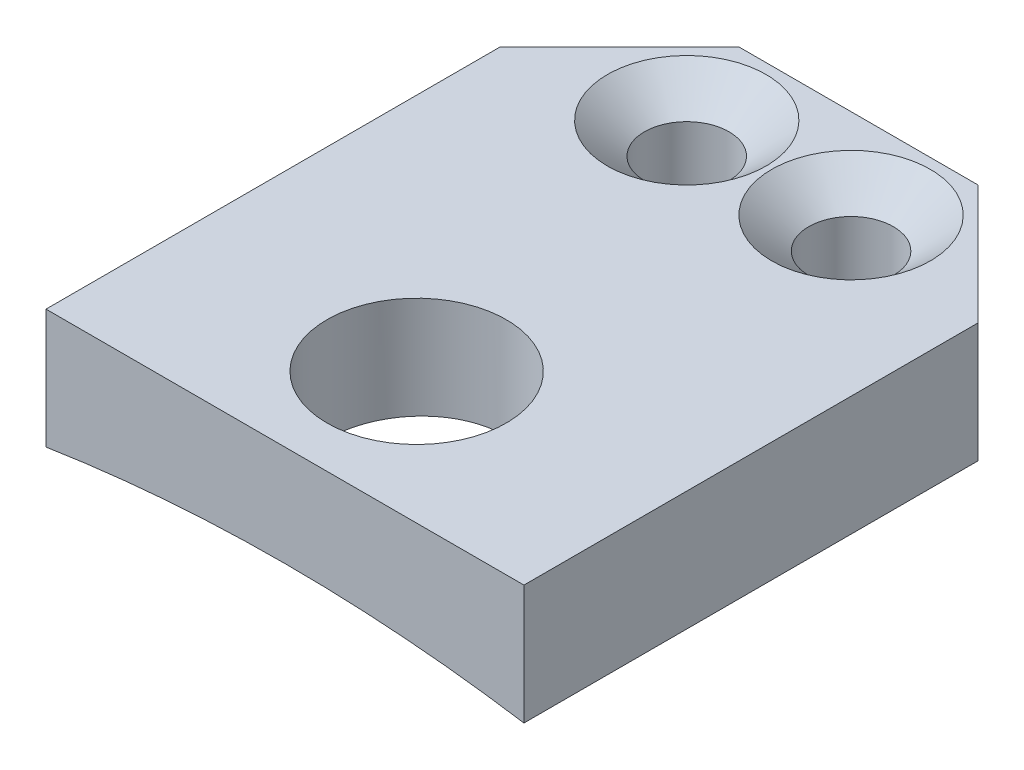
from build123d import *

# Parameters (mm, degrees)
BOSS_EXTRUDE1_DEPTH                               = 6.35
CSK_FOR_8_FLAT_HEAD_MACHINE_SCREW_100_D           = 4.4958
CSK_FOR_8_FLAT_HEAD_MACHINE_SCREW_100_CSINK_D     = 8.4328
CSK_FOR_8_FLAT_HEAD_MACHINE_SCREW_100_CSINK_ANGLE = 100
SKETCH2_R                                         = 82.042
CUT_EXTRUDE1_DEPTH                                = 43.217023873
SKETCH5_R                                         = 1.1303
CUT_EXTRUDE2_DEPTH                                = 35.271884391
SKETCH6_R                                         = 4.7625
CUT_EXTRUDE3_DEPTH                                = 35.271884391


with BuildPart() as part:
    # Sketch1 → Boss-Extrude1 (new body)
    with BuildSketch(Plane(origin=(0, 0, 0), x_dir=(1, 0, 0), z_dir=(0, 1, 0))):
        Polygon((-28.511825699, 11.575271113), (-22.161825699, 17.925271113), (-9.461825699, 17.925271113), (-3.111825699, 11.575271113), (-3.111825699, -12.554728887), (-28.511825699, -12.554728887), align=None)
    extrude(amount=BOSS_EXTRUDE1_DEPTH)

    # CSK for #8 Flat Head Machine Screw (100)1 (through all)
    with Locations(Plane(origin=(0, 6.35, 0), x_dir=(1, 0, 0), z_dir=(0, 1, 0))):
        with Locations((-20.177450699, 13.162771113), (-11.446200699, 13.162771113)):
            CounterSinkHole(CSK_FOR_8_FLAT_HEAD_MACHINE_SCREW_100_D / 2, CSK_FOR_8_FLAT_HEAD_MACHINE_SCREW_100_CSINK_D / 2, counter_sink_angle=CSK_FOR_8_FLAT_HEAD_MACHINE_SCREW_100_CSINK_ANGLE)

    # Sketch2 → Cut-Extrude1 (cut, through all)
    with BuildSketch(Plane.XY.offset(12.554728887)):
        with Locations((-15.811825699, -81.053067579)):
            Circle(SKETCH2_R)
    extrude(amount=-CUT_EXTRUDE1_DEPTH, mode=Mode.SUBTRACT)

    # Sketch5 → Cut-Extrude2 (cut, through all)
    with BuildSketch(Plane(origin=(0, 6.35, 0), x_dir=(1, 0, 0), z_dir=(0, 1, 0))):
        with Locations(Location((-15.799380503, -5.569728887, 0), (0, 0, 270))):
            Circle(SKETCH5_R)
    extrude(amount=-CUT_EXTRUDE2_DEPTH, mode=Mode.SUBTRACT)

    # Sketch6 → Cut-Extrude3 (cut, through all)
    with BuildSketch(Plane(origin=(0, 6.35, 0), x_dir=(1, 0, 0), z_dir=(0, 1, 0))):
        with Locations(Location((-15.799380503, -5.569728887, 0), (0, 0, 270))):
            Circle(SKETCH6_R)
    extrude(amount=-CUT_EXTRUDE3_DEPTH, mode=Mode.SUBTRACT)


solid = part.part
